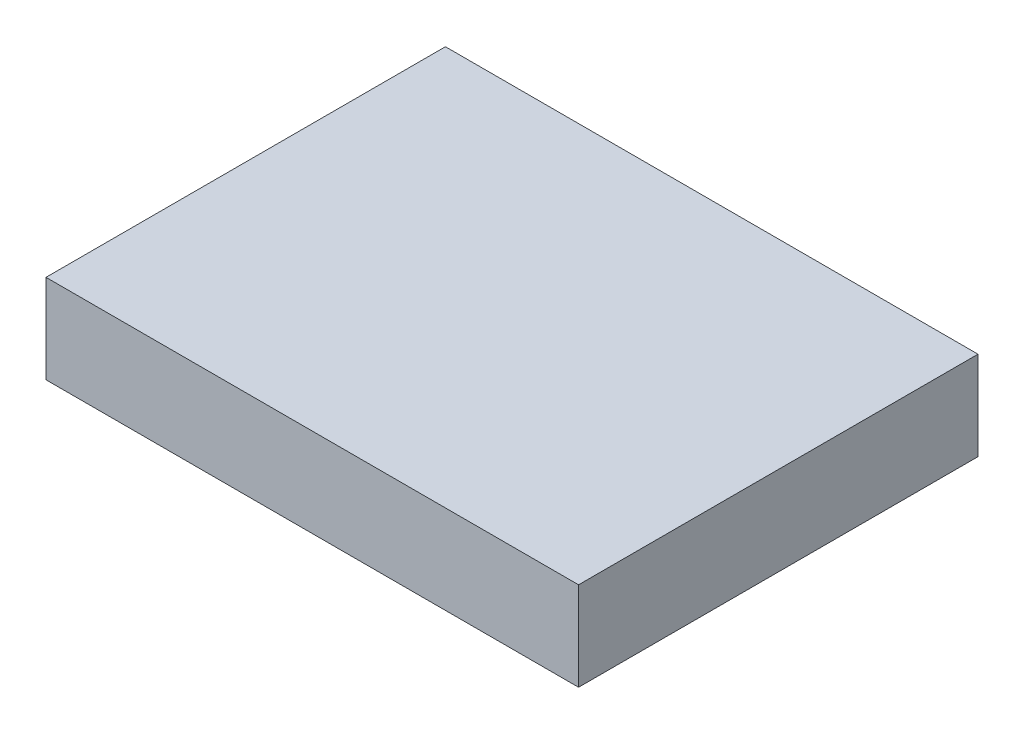
from build123d import *

# Parameters (mm, degrees)
SKETCH1_W           = 60
SKETCH1_H           = 45
BOSS_EXTRUDE1_DEPTH = 10


with BuildPart() as part:
    # Sketch1 → Boss-Extrude1 (new body)
    with BuildSketch(Plane(origin=(0, 0, 0), x_dir=(1, 0, 0), z_dir=(0, 1, 0))):
        Rectangle(SKETCH1_W, SKETCH1_H)
    extrude(amount=BOSS_EXTRUDE1_DEPTH)


solid = part.part
